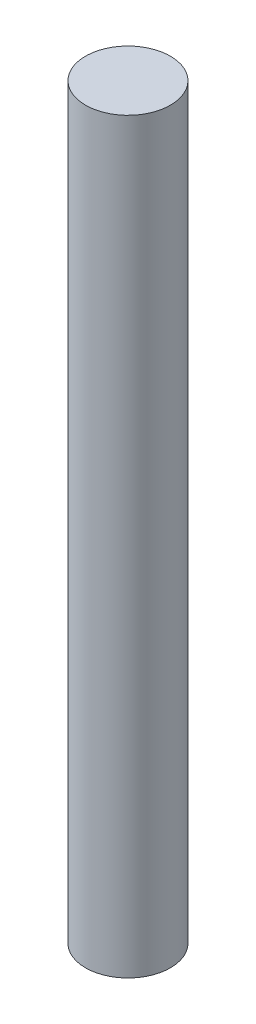
from build123d import *

# Parameters (mm, degrees)
SKETCH1_R           = 7.9375
BOSS_EXTRUDE1_DEPTH = 139.7


with BuildPart() as part:
    # Sketch1 → Boss-Extrude1 (new body)
    with BuildSketch(Plane(origin=(0, 0, 0), x_dir=(1, 0, 0), z_dir=(0, 1, 0))):
        with Locations(Location((0, 0, 0), (0, 0, 270))):
            Circle(SKETCH1_R)
    extrude(amount=BOSS_EXTRUDE1_DEPTH)


solid = part.part
